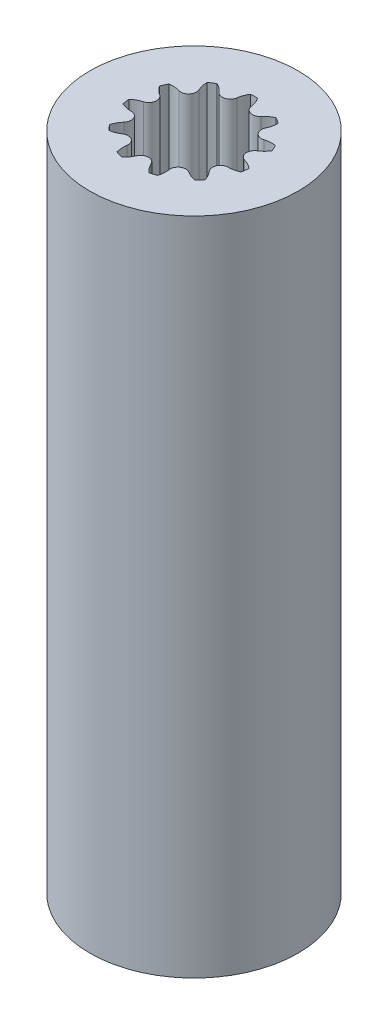
from build123d import *

# Parameters (mm, degrees)
SKETCH1_R           = 4.5
BOSS_EXTRUDE1_DEPTH = 8
BOSS_EXTRUDE2_START = 6
SKETCH2_R           = 4.5
SKETCH2_R_2         = 2.175
BOSS_EXTRUDE2_DEPTH = 6
BOSS_EXTRUDE3_START = 1.5
SKETCH3_R           = 4.5
BOSS_EXTRUDE3_DEPTH = 1.5
BOSS_EXTRUDE4_START = 13
SKETCH4_R           = 4.5
BOSS_EXTRUDE4_DEPTH = 13


with BuildPart() as part:
    # Sketch1 → Boss-Extrude1 (new body)
    with BuildSketch(Plane(origin=(0, 0, 0), x_dir=(1, 0, 0), z_dir=(0, 1, 0))):
        with Locations(Location((0, 0, 0), (0, 0, 270))):
            Circle(SKETCH1_R)
        with BuildLine():
            ThreePointArc((-0.909869568, -1.991090343), (-0.907761332, -1.974465286), (-0.906473122, -1.957756676))
            ThreePointArc((-0.906473122, -1.957756676), (-1.062514579, -1.653304957), (-1.404275568, -1.63783847))
            ThreePointArc((-1.404275568, -1.63783847), (-1.418939112, -1.645951275), (-1.433186003, -1.654775291))
            ThreePointArc((-1.433186003, -1.654775291), (-1.638194551, -1.758833668), (-1.86090652, -1.815895294))
            ThreePointArc((-1.86090652, -1.815895294), (-1.965014118, -1.702694426), (-2.062246708, -1.58353633))
            ThreePointArc((-2.062246708, -1.58353633), (-1.97407067, -1.371211963), (-1.841895699, -1.183099158))
            ThreePointArc((-1.841895699, -1.183099158), (-1.831133954, -1.170253069), (-1.821016886, -1.15689335))
            ThreePointArc((-1.821016886, -1.15689335), (-1.787688286, -0.816409885), (-2.066834111, -0.618628708))
            ThreePointArc((-2.066834111, -0.618628708), (-2.083555984, -0.617525923), (-2.100311854, -0.617246707))
            ThreePointArc((-2.100311854, -0.617246707), (-2.329034225, -0.593950196), (-2.5472413, -0.521546309))
            ThreePointArc((-2.5472413, -0.521546309), (-2.573621175, -0.370030862), (-2.590996705, -0.217220785))
            ThreePointArc((-2.590996705, -0.217220785), (-2.402027082, -0.086273727), (-2.18913296, 0.00051765))
            ThreePointArc((-2.18913296, 0.00051765), (-2.173134484, 0.00550623), (-2.157400655, 0.01127544))
            ThreePointArc((-2.157400655, 0.01127544), (-1.945283594, 0.279689557), (-2.073187428, 0.596991297))
            ThreePointArc((-2.073187428, 0.596991297), (-2.086658552, 0.606959546), (-2.100603532, 0.616253345))
            ThreePointArc((-2.100603532, 0.616253345), (-2.280421989, 0.759508267), (-2.424844966, 0.938389944))
            ThreePointArc((-2.424844966, 0.938389944), (-2.365121694, 1.080114886), (-2.297123554, 1.218060823))
            ThreePointArc((-2.297123554, 1.218060823), (-2.067356867, 1.226055807), (-1.841335974, 1.183970107))
            ThreePointArc((-1.841335974, 1.183970107), (-1.825180169, 1.179517339), (-1.80882496, 1.175864357))
            ThreePointArc((-1.80882496, 1.175864357), (-1.485265106, 1.28698954), (-1.421318385, 1.623070784))
            ThreePointArc((-1.421318385, 1.623070784), (-1.427261774, 1.638739648), (-1.43396843, 1.654097314))
            ThreePointArc((-1.43396843, 1.654097314), (-1.507791885, 1.871828221), (-1.532577488, 2.10039402))
            ThreePointArc((-1.532577488, 2.10039402), (-1.405712785, 2.18733179), (-1.273929906, 2.266616727))
            ThreePointArc((-1.273929906, 2.266616727), (-1.076315454, 2.149121286), (-0.908927826, 1.991520422))
            ThreePointArc((-0.908927826, 1.991520422), (-0.897744047, 1.979040027), (-0.88596012, 1.96712465))
            ThreePointArc((-0.88596012, 1.96712465), (-0.55368544, 1.885679438), (-0.318190798, 2.133836765))
            ThreePointArc((-0.318190798, 2.133836765), (-0.314719467, 2.15023149), (-0.312058484, 2.166777073))
            ThreePointArc((-0.312058484, 2.166777073), (-0.25644851, 2.389855941), (-0.153727486, 2.595537835))
            ThreePointArc((-0.153727486, 2.595537835), (-0.076897381, 2.598948939), (0, 2.600086305))
            ThreePointArc((0, 2.600086305), (0.076897381, 2.598948939), (0.153727486, 2.595537835))
            ThreePointArc((0.153727486, 2.595537835), (0.25644851, 2.389855941), (0.312058484, 2.166777073))
            ThreePointArc((0.312058484, 2.166777073), (0.314719467, 2.15023149), (0.318190798, 2.133836765))
            ThreePointArc((0.318190798, 2.133836765), (0.55368544, 1.885679438), (0.88596012, 1.96712465))
            ThreePointArc((0.88596012, 1.96712465), (0.897744047, 1.979040027), (0.908927826, 1.991520422))
            ThreePointArc((0.908927826, 1.991520422), (1.076315454, 2.149121286), (1.273929906, 2.266616727))
            ThreePointArc((1.273929906, 2.266616727), (1.405712785, 2.18733179), (1.532577488, 2.10039402))
            ThreePointArc((1.532577488, 2.10039402), (1.507791885, 1.871828221), (1.43396843, 1.654097314))
            ThreePointArc((1.43396843, 1.654097314), (1.427261774, 1.638739648), (1.421318385, 1.623070784))
            ThreePointArc((1.421318385, 1.623070784), (1.485265106, 1.28698954), (1.80882496, 1.175864357))
            ThreePointArc((1.80882496, 1.175864357), (1.825180169, 1.179517339), (1.841335974, 1.183970107))
            ThreePointArc((1.841335974, 1.183970107), (2.067356867, 1.226055807), (2.297123554, 1.218060823))
            ThreePointArc((2.297123554, 1.218060823), (2.365121694, 1.080114886), (2.424844966, 0.938389944))
            ThreePointArc((2.424844966, 0.938389944), (2.280421989, 0.759508267), (2.100603532, 0.616253345))
            ThreePointArc((2.100603532, 0.616253345), (2.086658552, 0.606959546), (2.073187428, 0.596991297))
            ThreePointArc((2.073187428, 0.596991297), (1.945283594, 0.279689557), (2.157400655, 0.01127544))
            ThreePointArc((2.157400655, 0.01127544), (2.173134484, 0.00550623), (2.18913296, 0.00051765))
            ThreePointArc((2.18913296, 0.00051765), (2.402027082, -0.086273727), (2.590996705, -0.217220785))
            ThreePointArc((2.590996705, -0.217220785), (2.573621175, -0.370030862), (2.5472413, -0.521546309))
            ThreePointArc((2.5472413, -0.521546309), (2.329034225, -0.593950196), (2.100311854, -0.617246707))
            ThreePointArc((2.100311854, -0.617246707), (2.083555984, -0.617525923), (2.066834111, -0.618628708))
            ThreePointArc((2.066834111, -0.618628708), (1.787688286, -0.816409885), (1.821016886, -1.15689335))
            ThreePointArc((1.821016886, -1.15689335), (1.831133954, -1.170253069), (1.841895699, -1.183099158))
            ThreePointArc((1.841895699, -1.183099158), (1.97407067, -1.371211963), (2.062246708, -1.58353633))
            ThreePointArc((2.062246708, -1.58353633), (1.965014118, -1.702694426), (1.86090652, -1.815895294))
            ThreePointArc((1.86090652, -1.815895294), (1.638194552, -1.758833667), (1.433186005, -1.65477529))
            ThreePointArc((1.433186005, -1.65477529), (1.418939115, -1.645951274), (1.40427557, -1.637838469))
            ThreePointArc((1.40427557, -1.637838469), (1.06251458, -1.653304956), (0.906473122, -1.957756676))
            ThreePointArc((0.906473122, -1.957756676), (0.907761332, -1.974465287), (0.909869568, -1.991090343))
            ThreePointArc((0.909869568, -1.991090343), (0.919360768, -2.220800089), (0.878747953, -2.447090278))
            ThreePointArc((0.878747953, -2.447090278), (0.732528963, -2.49476454), (0.583747068, -2.533710353))
            ThreePointArc((0.583747068, -2.533710353), (0.427239681, -2.365299878), (0.311033722, -2.166924412))
            ThreePointArc((0.311033722, -2.166924412), (0.303819099, -2.151798727), (0.295869453, -2.13704609))
            ThreePointArc((0.295869453, -2.13704609), (0, -1.965287386), (-0.295869453, -2.13704609))
            ThreePointArc((-0.295869453, -2.13704609), (-0.303819099, -2.151798726), (-0.311033722, -2.166924412))
            ThreePointArc((-0.311033722, -2.166924412), (-0.427239681, -2.365299878), (-0.583747068, -2.533710353))
            ThreePointArc((-0.583747068, -2.533710353), (-0.732528963, -2.49476454), (-0.878747953, -2.447090278))
            ThreePointArc((-0.878747953, -2.447090278), (-0.919360769, -2.220800089), (-0.909869568, -1.991090343))
        make_face(mode=Mode.SUBTRACT)
    extrude(amount=BOSS_EXTRUDE1_DEPTH)

    # Sketch2 → Boss-Extrude2 (add)
    with BuildSketch(Plane.XZ.offset(BOSS_EXTRUDE2_START)):
        with Locations(Location((0, 0, 0), (0, 0, 270))):
            Circle(SKETCH2_R)
        with Locations(Location((0, 0, 0), (0, 0, 98.053222352))):
            Circle(SKETCH2_R_2, mode=Mode.SUBTRACT)
    extrude(amount=-BOSS_EXTRUDE2_DEPTH)

    # Sketch3 → Boss-Extrude3 (add)
    with BuildSketch(Plane.XZ.offset(6).offset(BOSS_EXTRUDE3_START)):
        with Locations(Location((0, 0, 0), (0, 0, 270))):
            Circle(SKETCH3_R)
    extrude(amount=-BOSS_EXTRUDE3_DEPTH)

    # Sketch4 → Boss-Extrude4 (add)
    with BuildSketch(Plane.XZ.offset(7.5).offset(BOSS_EXTRUDE4_START)):
        with Locations(Location((0, 0, 0), (0, 0, 270))):
            Circle(SKETCH4_R)
        with BuildLine():
            Line((-1.747140521, 2.5), (1.747140521, 2.5))
            ThreePointArc((1.747140521, 2.5), (0, -3.05), (-1.747140521, 2.5))
        make_face(mode=Mode.SUBTRACT)
    extrude(amount=-BOSS_EXTRUDE4_DEPTH)


solid = part.part
